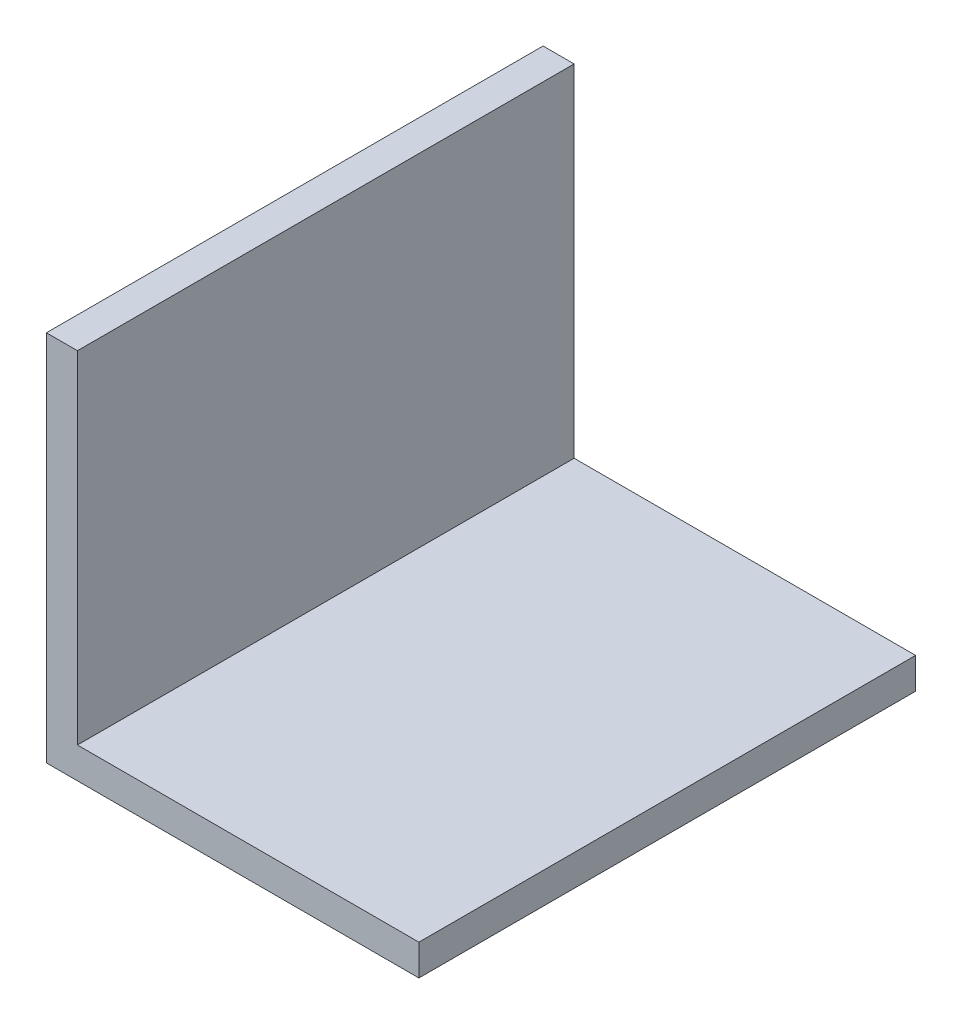
from build123d import *

# Parameters (mm, degrees)
BOSS_EXTRUDE1_DEPTH = 25.4


with BuildPart() as part:
    # Sketch1 → Boss-Extrude1 (new body)
    with BuildSketch(Plane.XY):
        Polygon((0, 0), (0, 19.05), (1.5875, 19.05), (1.5875, 1.5875), (19.05, 1.5875), (19.05, 0), align=None)
    extrude(amount=BOSS_EXTRUDE1_DEPTH)


solid = part.part
